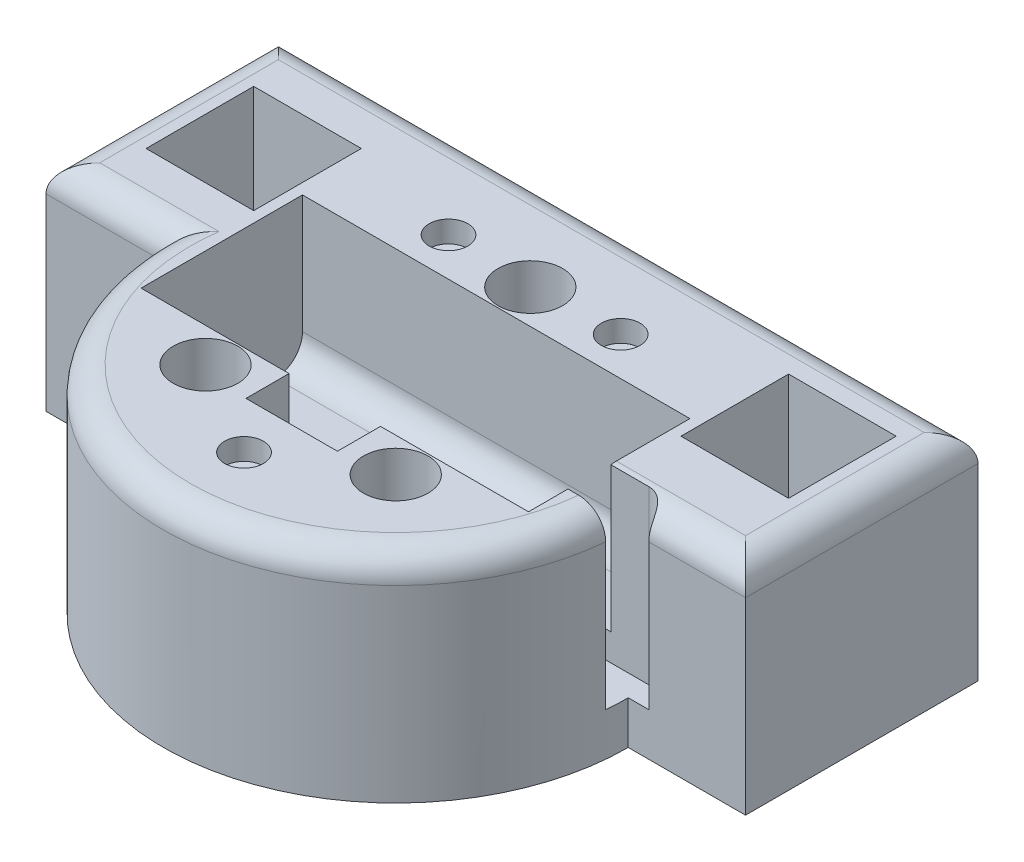
from build123d import *

# Parameters (mm, degrees)
SKETCH1_R           = 43.2
BOSS_EXTRUDE1_DEPTH = 40
SKETCH2_R           = 3
SKETCH2_W           = 20
SKETCH2_H           = 20
CUT_EXTRUDE1_DEPTH  = 50
SKETCH3_W           = 8.5
SKETCH3_H           = 8
SKETCH3_W_2         = 72
SKETCH3_H_2         = 30
CUT_EXTRUDE2_DEPTH  = 27
FILLET1_R           = 5
CUT_EXTRUDE3_START  = -32
SKETCH4_R           = 4
CUT_EXTRUDE3_DEPTH  = 32
SKETCH5_R           = 3.6
CUT_EXTRUDE4_DEPTH  = 4
FILLET3_R           = 5
SKETCH7_R           = 6
CUT_EXTRUDE5_DEPTH  = 36


with BuildPart() as part:
    # Sketch1 → Boss-Extrude1 (new body)
    with BuildSketch(Plane(origin=(0, 0, 0), x_dir=(1, 0, 0), z_dir=(0, 1, 0))):
        Circle(SKETCH1_R)
        with BuildLine():
            Line((0, 43.2), (-65, 43.2))
            Line((-65, 43.2), (-65, 0))
            Line((-65, 0), (-43.2, 0))
            ThreePointArc((-43.2, 0), (-30.547012947, 30.547012947), (0, 43.2))
        make_face()
        with BuildLine():
            Line((65, 43.2), (0, 43.2))
            ThreePointArc((0, 43.2), (30.547012947, 30.547012947), (43.2, 0))
            Line((43.2, 0), (65, 0))
            Line((65, 0), (65, 43.2))
        make_face()
    extrude(amount=BOSS_EXTRUDE1_DEPTH)

    # Sketch2 → Cut-Extrude1 (cut)
    with BuildSketch(Plane(origin=(0, 40, 0), x_dir=(1, 0, 0), z_dir=(0, 1, 0))):
        with Locations(Location((0, 25, 0), (0, 0, 270))):
            Circle(SKETCH2_R)
        with Locations(Location((17.67766953, -17.67766953, 0), (0, 0, 270))):
            Circle(SKETCH2_R)
        with Locations(Location((-17.67766953, -17.67766953, 0), (0, 0, 270))):
            Circle(SKETCH2_R)
        with Locations((48, 25)):
            Rectangle(SKETCH2_W, SKETCH2_H)
        with Locations((-48, 21.6)):
            Rectangle(SKETCH2_W, SKETCH2_H)
    extrude(amount=-CUT_EXTRUDE1_DEPTH, mode=Mode.SUBTRACT)

    # Sketch3 → Cut-Extrude2 (cut)
    with BuildSketch(Plane(origin=(0, 40, 0), x_dir=(1, 0, 0), z_dir=(0, 1, 0))):
        with Locations((4.25, -15.338834765)):
            Rectangle(SKETCH3_W, SKETCH3_H)
        with Locations((-4.25, -15.338834765)):
            Rectangle(SKETCH3_W, SKETCH3_H)
        with Locations((0, 3.661165235)):
            Rectangle(SKETCH3_W_2, SKETCH3_H_2)
    extrude(amount=-CUT_EXTRUDE2_DEPTH, mode=Mode.SUBTRACT)

    # Fillet1
    fillet1_edges = [part.edges().sort_by_distance(p)[0] for p in [
        (-22.25, 13, 11.338834765),
        (22.25, 13, 11.338834765),
        (0, 13, -18.661165235),
    ]]
    fillet(fillet1_edges, radius=FILLET1_R)

    # Sketch4 → Cut-Extrude3 (cut)
    with BuildSketch(Plane(origin=(0, 40, 0), x_dir=(1, 0, 0), z_dir=(0, 1, 0)).offset(CUT_EXTRUDE3_START)):
        with BuildLine():
            Line((43.014416188, 4), (36, 4))
            Line((36, 4), (36, -4))
            Line((36, -4), (43.014416188, -4))
            ThreePointArc((43.014416188, -4), (43.153579106, -2.002151427), (43.2, 0))
            Line((43.2, 0), (47.014416188, 0))
            ThreePointArc((47.014416188, 0), (45.842843313, 2.828427125), (43.014416188, 4))
        make_face()
        with BuildLine():
            Line((36, 4), (23.014416188, 4))
            ThreePointArc((23.014416188, 4), (25.842843313, 2.828427125), (27.014416188, 0))
            ThreePointArc((27.014416188, 0), (25.842843313, -2.828427125), (23.014416188, -4))
            Line((23.014416188, -4), (36, -4))
            Line((36, -4), (36, 4))
        make_face()
        with Locations((23.014416188, 0)):
            Circle(SKETCH4_R)
        with BuildLine():
            ThreePointArc((43.014416188, -4), (45.842843313, -2.828427125), (47.014416188, 0))
            Line((47.014416188, 0), (43.2, 0))
            ThreePointArc((43.2, 0), (43.153579106, -2.002151427), (43.014416188, -4))
        make_face()
    extrude(amount=CUT_EXTRUDE3_DEPTH, mode=Mode.SUBTRACT)

    # Sketch5 → Cut-Extrude4 (cut)
    with BuildSketch(Plane(origin=(0, 40, 0), x_dir=(1, 0, 0), z_dir=(0, 1, 0))):
        with Locations(Location((16, 25.8, 0), (0, 0, 270))):
            Circle(SKETCH5_R)
        with Locations(Location((-16, 25.8, 0), (0, 0, 270))):
            Circle(SKETCH5_R)
        with Locations(Location((0, -28.2, 0), (0, 0, 270))):
            Circle(SKETCH5_R)
    extrude(amount=-CUT_EXTRUDE4_DEPTH, mode=Mode.SUBTRACT)

    # Fillet3
    fillet3_edges = [part.edges().sort_by_distance(p)[0] for p in [
        (-2.002151427, 40, 43.153579106),
        (56.007208094, 40, 0),
        (-54.1, 40, 0),
        (-65, 40, -21.6),
        (65, 40, -21.6),
        (0, 40, -43.2),
    ]]
    fillet(fillet3_edges, radius=FILLET3_R)

    # Sketch7 → Cut-Extrude5 (cut)
    with BuildSketch(Plane(origin=(0, 40, 0), x_dir=(1, 0, 0), z_dir=(0, 1, 0))):
        with Locations(Location((0, 25, 0), (0, 0, 270))):
            Circle(SKETCH7_R)
        with Locations(Location((17.67766953, -17.67766953, 0), (0, 0, 270))):
            Circle(SKETCH7_R)
        with Locations(Location((-17.67766953, -17.67766953, 0), (0, 0, 270))):
            Circle(SKETCH7_R)
    extrude(amount=-CUT_EXTRUDE5_DEPTH, mode=Mode.SUBTRACT)


solid = part.part
